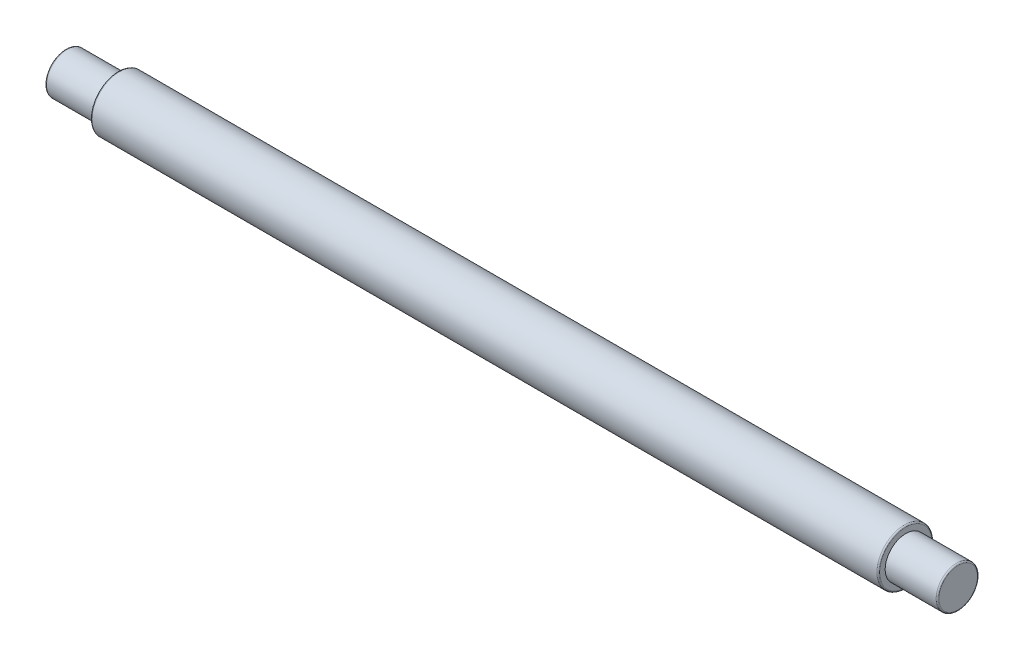
from build123d import *

# Parameters (mm, degrees)
RADYUS1_R = 1


with BuildPart() as part:
    # Çizim1 → Döndür1 (revolve)
    with BuildSketch(Plane.XY, mode=Mode.PRIVATE) as d_nd_r1_sk:
        Polygon((-324, 0), (-324, 15), (-286, 15), (-286, 20), (286, 20), (286, 15), (324, 15), (324, 0), align=None)
    revolve(d_nd_r1_sk.sketch.rotate(Axis((-324, 0, 0), (1, 0, 0)), 180), axis=Axis((-324, 0, 0), (1, 0, 0)))

    # Radyus1
    radyus1_edges = [part.edges().sort_by_distance(p)[0] for p in [
        (324, 15, 0),
        (286, 20, 0),
        (-286, 20, 0),
        (-324, 15, 0),
    ]]
    fillet(radyus1_edges, radius=RADYUS1_R)


solid = part.part
